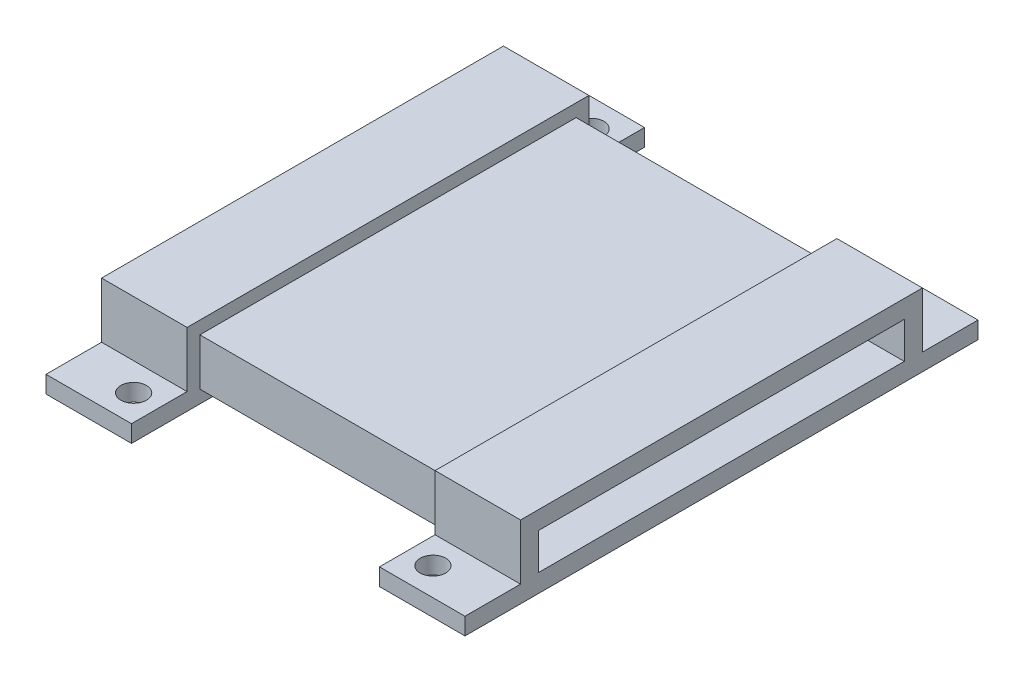
from build123d import *

# Parameters (mm, degrees)
SKETCH1_W               = 49
SKETCH1_H               = 60
BOSS_EXTRUDE1_DEPTH     = 15
SKETCH5_W               = 6.5
SKETCH5_H               = 13
CUT_EXTRUDE2_DEPTH      = 54
SKETCH2_R               = 1.5
CUT_EXTRUDE3_DEPTH      = 54
SKETCH7_W               = 6.5
SKETCH7_H               = 13
CUT_EXTRUDE4_DEPTH      = 54
SKETCH8_W               = 29
SKETCH8_H               = 1.5
CUT_EXTRUDE5_DEPTH      = 54
SKETCH9_W               = 29
SKETCH9_H               = 1.5
CUT_EXTRUDE6_DEPTH      = 54
CUT_EXTRUDE7_DEPTH      = 17
CUT_EXTRUDE7_DEPTH_BACK = 76
SKETCH14_W              = 29
SKETCH14_H              = 1.5
SKETCH16_W              = 29
SKETCH16_H              = 1.5
CUT_EXTRUDE8_DEPTH      = 17
SKETCH17_W              = 29
SKETCH17_H              = 0.5
CUT_EXTRUDE9_DEPTH      = 7
SKETCH18_W              = 29
SKETCH18_H              = 0.5
CUT_EXTRUDE10_DEPTH     = 7
SKETCH19_W              = 42.757359313
SKETCH19_H              = 4.257359312
CUT_EXTRUDE12_DEPTH     = 51


with BuildPart() as part:
    # Sketch1 → Boss-Extrude1 (new body)
    with BuildSketch(Plane(origin=(0, 0, 0), x_dir=(1, 0, 0), z_dir=(0, 1, 0))):
        with Locations((-27.855953383, 4.497926564)):
            Rectangle(SKETCH1_W, SKETCH1_H)
    extrude(amount=BOSS_EXTRUDE1_DEPTH)

    # Sketch5 → Cut-Extrude2 (cut)
    with BuildSketch(Plane.ZY.offset(52.355953383)):
        with Locations((-31.247926564, 8.5)):
            Rectangle(SKETCH5_W, SKETCH5_H)
    extrude(amount=-CUT_EXTRUDE2_DEPTH, mode=Mode.SUBTRACT)

    # Sketch2 → Cut-Extrude3 (cut)
    with BuildSketch(Plane(origin=(0, 15, 0), x_dir=(-1, 0, 0), z_dir=(0, 1, 0))):
        with Locations(Location((45.355953383, -31.247926564, 0), (0, 0, 270))):
            Circle(SKETCH2_R)
        with Locations(Location((10.355953383, -31.247926564, 0), (0, 0, 270))):
            Circle(SKETCH2_R)
        with Locations(Location((10.355953383, 22.252073436, 0), (0, 0, 90))):
            Circle(SKETCH2_R)
        with Locations(Location((45.355953383, 22.252073436, 0), (0, 0, 90))):
            Circle(SKETCH2_R)
    extrude(amount=-CUT_EXTRUDE3_DEPTH, mode=Mode.SUBTRACT)

    # Sketch7 → Cut-Extrude4 (cut)
    with BuildSketch(Plane.ZY.offset(52.355953383)):
        with Locations((22.252073436, 8.5)):
            Rectangle(SKETCH7_W, SKETCH7_H)
    extrude(amount=-CUT_EXTRUDE4_DEPTH, mode=Mode.SUBTRACT)

    # Sketch8 → Cut-Extrude5 (cut)
    with BuildSketch(Plane.XY.offset(19.002073436)):
        Polygon((-52.355953383, 8.5), (-42.355953383, 8.5), (-13.355953383, 8.5), (-3.355953383, 8.5), (-3.355953383, 15), (-52.355953383, 15), align=None)
        with Locations((-27.855953383, 7.75)):
            Rectangle(SKETCH8_W, SKETCH8_H)
    extrude(amount=-CUT_EXTRUDE5_DEPTH, mode=Mode.SUBTRACT)

    # Sketch9 → Cut-Extrude6 (cut)
    with BuildSketch(Plane(origin=(0, 7, 0), x_dir=(-1, 0, 0), z_dir=(0, 1, 0))):
        with Locations((27.855953383, -27.247926564)):
            Rectangle(SKETCH9_W, SKETCH9_H)
    extrude(amount=-CUT_EXTRUDE6_DEPTH, mode=Mode.SUBTRACT)

    # Sketch14 → Cut-Extrude7 (cut, two sides: drawn at the far end of the back side and taken through both)
    with BuildSketch(Plane(origin=(0, 0, -26.497926564), x_dir=(-1, 0, 0), z_dir=(0, 0, -1)).offset(-CUT_EXTRUDE7_DEPTH_BACK)):
        with Locations((27.855953383, 0.75)):
            Rectangle(SKETCH14_W, SKETCH14_H)
    extrude(amount=CUT_EXTRUDE7_DEPTH + CUT_EXTRUDE7_DEPTH_BACK, mode=Mode.SUBTRACT)

    # Sketch16 → Cut-Extrude8 (cut)
    with BuildSketch(Plane(origin=(0, 7, 0), x_dir=(-1, 0, 0), z_dir=(0, 1, 0))):
        with Locations((27.855953383, 18.252073436)):
            Rectangle(SKETCH16_W, SKETCH16_H)
    extrude(amount=-CUT_EXTRUDE8_DEPTH, mode=Mode.SUBTRACT)

    # Sketch17 → Cut-Extrude9 (cut)
    with BuildSketch(Plane.XY.offset(25.502073436)):
        with Locations((-27.855953383, 1.75)):
            Rectangle(SKETCH17_W, SKETCH17_H)
    extrude(amount=-CUT_EXTRUDE9_DEPTH, mode=Mode.SUBTRACT)

    # Sketch18 → Cut-Extrude10 (cut)
    with BuildSketch(Plane(origin=(0, 0, -34.497926564), x_dir=(-1, 0, 0), z_dir=(0, 0, -1))):
        with Locations((27.855953383, 1.75)):
            Rectangle(SKETCH18_W, SKETCH18_H)
    extrude(amount=-CUT_EXTRUDE10_DEPTH, mode=Mode.SUBTRACT)

    # Sketch19 → Cut-Extrude12 (cut)
    with BuildSketch(Plane.ZY.offset(52.355953383)):
        with Locations((-4.497926565, 4.25)):
            Rectangle(SKETCH19_W, SKETCH19_H)
    extrude(amount=-CUT_EXTRUDE12_DEPTH, mode=Mode.SUBTRACT)


solid = part.part
